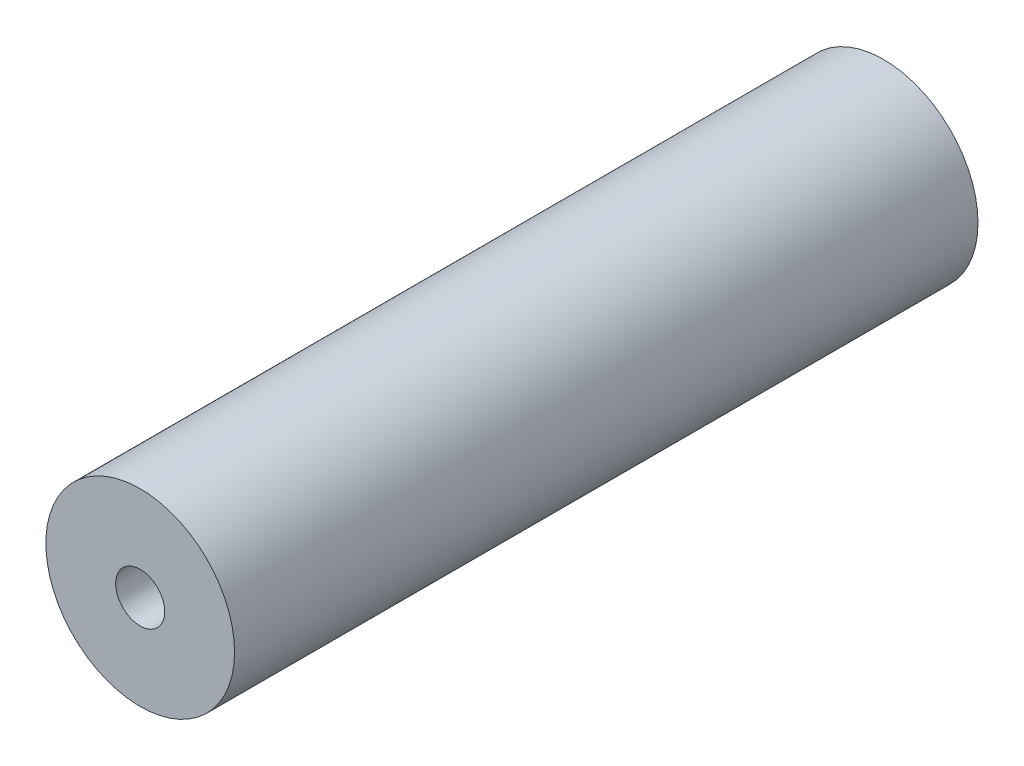
from build123d import *

# Parameters (mm, degrees)
SKETCH_1_R      = 5
SKETCH_1_R_2    = 1.3
EXTRUDE_2_DEPTH = 39.4


with BuildPart() as part:
    # ｽｹｯﾁ1 → ﾎﾞｽ - 押し出し2 (new body)
    with BuildSketch(Plane.XY):
        Circle(SKETCH_1_R)
        Circle(SKETCH_1_R_2, mode=Mode.SUBTRACT)
    extrude(amount=EXTRUDE_2_DEPTH)


solid = part.part
